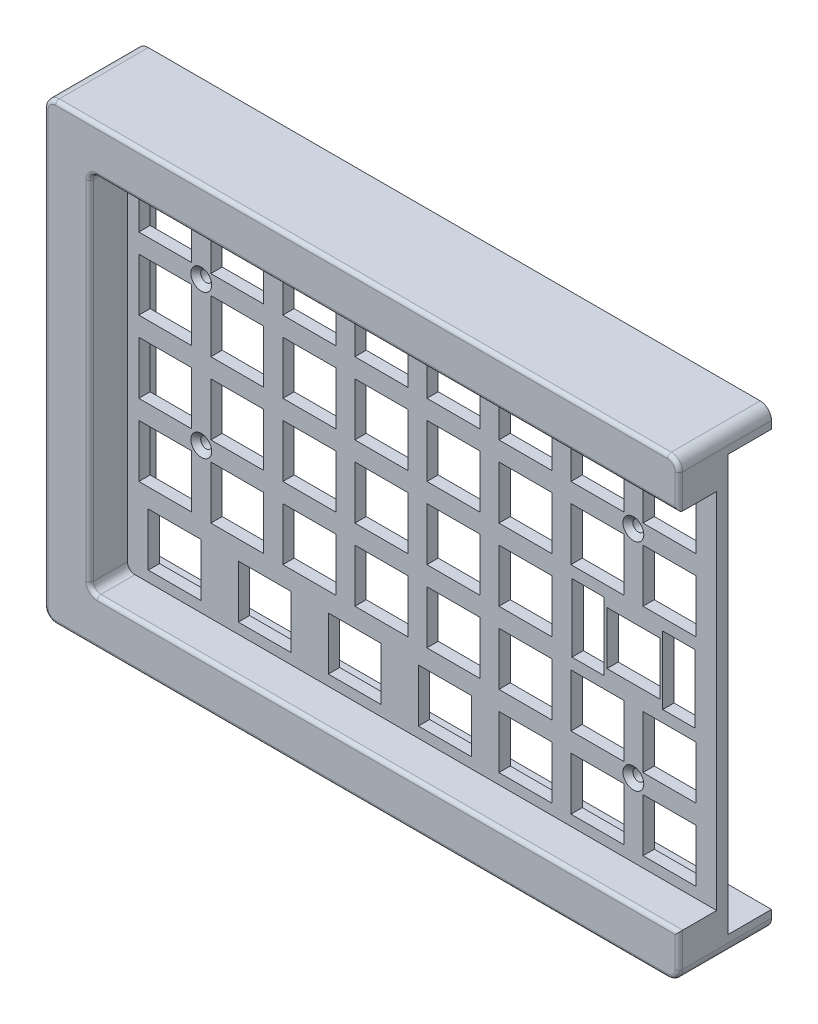
from build123d import *

# Parameters (mm, degrees)
MAIN_EXTRUSION_DEPTH                                 = 24.5
FRONT_CAVE_DEPTH                                     = 10
SKETCH2_W                                            = 14
SKETCH2_H                                            = 14
SKETCH2_W_2                                          = 8.5
SKETCH2_H_2                                          = 18
KEY_CUTOUTS_DEPTH                                    = 3
CSK_FOR_M2_5_COUNTERSUNK_FLAT_HEAD_SCREW_D           = 2.9
CSK_FOR_M2_5_COUNTERSUNK_FLAT_HEAD_SCREW_CSINK_D     = 5.5
CSK_FOR_M2_5_COUNTERSUNK_FLAT_HEAD_SCREW_CSINK_ANGLE = 90
SKETCH4_W                                            = 162.85
SKETCH4_H                                            = 110
CUT_EXTRUDE1_DEPTH                                   = 11.5
CUT_EXTRUDE3_DEPTH                                   = 2.5
CUT_EXTRUDE4_DEPTH                                   = 2.5
FILLET1_R                                            = 1
SKETCH10_W                                           = 3.2
SKETCH10_H                                           = 60
CUT_EXTRUDE5_DEPTH                                   = 8


with BuildPart() as part:
    # Sketch1 → Main Extrusion (new body)
    with BuildSketch(Plane.XY):
        with BuildLine():
            Line((-80.925, -60), (80.925, -60))
            ThreePointArc((80.925, -60), (83.046320344, -59.121320344), (83.925, -57))
            Line((83.925, -57), (83.925, 57))
            ThreePointArc((83.925, 57), (83.046320344, 59.121320344), (80.925, 60))
            Line((80.925, 60), (-80.925, 60))
            ThreePointArc((-80.925, 60), (-83.046320344, 59.121320344), (-83.925, 57))
            Line((-83.925, 57), (-83.925, -57))
            ThreePointArc((-83.925, -57), (-83.046320344, -59.121320344), (-80.925, -60))
        make_face()
    extrude(amount=MAIN_EXTRUSION_DEPTH)

    # Sketch3 → Front Cave (cut)
    with BuildSketch(Plane.XY.offset(24.5)):
        with BuildLine():
            Line((-69.925, 48), (82.025, 48))
            Line((82.025, 48), (83.925, 48))
            Line((83.925, 48), (83.925, 46))
            Line((83.925, 46), (83.925, -46))
            Line((83.925, -46), (83.925, -48))
            Line((83.925, -48), (82.025, -48))
            Line((82.025, -48), (-69.925, -48))
            ThreePointArc((-69.925, -48), (-71.339213562, -47.414213562), (-71.925, -46))
            Line((-71.925, -46), (-71.925, 46))
            ThreePointArc((-71.925, 46), (-71.339213562, 47.414213562), (-69.925, 48))
        make_face()
    extrude(amount=-FRONT_CAVE_DEPTH, mode=Mode.SUBTRACT)

    # Sketch2 → Key Cutouts (cut)
    with BuildSketch(Plane.XY.offset(14.5)):
        with Locations((-61.925, 38)):
            Rectangle(SKETCH2_W, SKETCH2_H)
        with Locations((-42.875, 38)):
            Rectangle(SKETCH2_W, SKETCH2_H)
        with Locations((-23.825, 38)):
            Rectangle(SKETCH2_W, SKETCH2_H)
        with Locations((-4.775, 38)):
            Rectangle(SKETCH2_W, SKETCH2_H)
        with Locations((14.275, 38)):
            Rectangle(SKETCH2_W, SKETCH2_H)
        with Locations((33.325, 38)):
            Rectangle(SKETCH2_W, SKETCH2_H)
        with Locations((52.375, 38)):
            Rectangle(SKETCH2_W, SKETCH2_H)
        with Locations((-35.613, -38.2)):
            Rectangle(SKETCH2_W, SKETCH2_H)
        with Locations((-59.425, -38.2)):
            Rectangle(SKETCH2_W, SKETCH2_H)
        with Locations((-11.801, -38.2)):
            Rectangle(SKETCH2_W, SKETCH2_H)
        with Locations((12.011, -38.2)):
            Rectangle(SKETCH2_W, SKETCH2_H)
        with Locations((73.9, -0.1)):
            Rectangle(SKETCH2_W_2, SKETCH2_H_2)
        with Locations((71.425, 38)):
            Rectangle(SKETCH2_W, SKETCH2_H)
        with Locations((-61.925, 18.95)):
            Rectangle(SKETCH2_W, SKETCH2_H)
        with Locations((-42.875, 18.95)):
            Rectangle(SKETCH2_W, SKETCH2_H)
        with Locations((-23.825, 18.95)):
            Rectangle(SKETCH2_W, SKETCH2_H)
        with Locations((-4.775, 18.95)):
            Rectangle(SKETCH2_W, SKETCH2_H)
        with Locations((14.275, 18.95)):
            Rectangle(SKETCH2_W, SKETCH2_H)
        with Locations((33.325, 18.95)):
            Rectangle(SKETCH2_W, SKETCH2_H)
        with Locations((52.375, 18.95)):
            Rectangle(SKETCH2_W, SKETCH2_H)
        with Locations((71.425, 18.95)):
            Rectangle(SKETCH2_W, SKETCH2_H)
        with Locations((-61.925, -0.1)):
            Rectangle(SKETCH2_W, SKETCH2_H)
        with Locations((-42.875, -0.1)):
            Rectangle(SKETCH2_W, SKETCH2_H)
        with Locations((-23.825, -0.1)):
            Rectangle(SKETCH2_W, SKETCH2_H)
        with Locations((-4.775, -0.1)):
            Rectangle(SKETCH2_W, SKETCH2_H)
        with Locations((14.275, -0.1)):
            Rectangle(SKETCH2_W, SKETCH2_H)
        with Locations((33.325, -0.1)):
            Rectangle(SKETCH2_W, SKETCH2_H)
        with Locations((-61.925, -19.15)):
            Rectangle(SKETCH2_W, SKETCH2_H)
        with Locations((-42.875, -19.15)):
            Rectangle(SKETCH2_W, SKETCH2_H)
        with Locations((-23.825, -19.15)):
            Rectangle(SKETCH2_W, SKETCH2_H)
        with Locations((-4.775, -19.15)):
            Rectangle(SKETCH2_W, SKETCH2_H)
        with Locations((14.275, -19.15)):
            Rectangle(SKETCH2_W, SKETCH2_H)
        with Locations((33.325, -19.15)):
            Rectangle(SKETCH2_W, SKETCH2_H)
        with Locations((52.375, -19.15)):
            Rectangle(SKETCH2_W, SKETCH2_H)
        with Locations((71.425, -19.15)):
            Rectangle(SKETCH2_W, SKETCH2_H)
        with Locations((61.9, -0.1)):
            Rectangle(SKETCH2_W, SKETCH2_H)
        with Locations((49.9, -0.1)):
            Rectangle(SKETCH2_W_2, SKETCH2_H_2)
        with Locations((33.325, -38.2)):
            Rectangle(SKETCH2_W, SKETCH2_H)
        with Locations((52.375, -38.2)):
            Rectangle(SKETCH2_W, SKETCH2_H)
        with Locations((71.425, -38.2)):
            Rectangle(SKETCH2_W, SKETCH2_H)
    extrude(amount=-KEY_CUTOUTS_DEPTH, mode=Mode.SUBTRACT)

    # CSK for M2.5 Countersunk Flat Head Screw1 (through all)
    with Locations(Plane(origin=(-52.4, 28.475, 14.5), x_dir=(1, 0, 0), z_dir=(0, 0, 1))):
        with Locations((0, 0), (114.295, -57.145), (0, -38.1), (114.295, -0.005)):
            CounterSinkHole(CSK_FOR_M2_5_COUNTERSUNK_FLAT_HEAD_SCREW_D / 2, CSK_FOR_M2_5_COUNTERSUNK_FLAT_HEAD_SCREW_CSINK_D / 2, counter_sink_angle=CSK_FOR_M2_5_COUNTERSUNK_FLAT_HEAD_SCREW_CSINK_ANGLE)

    # Sketch4 → Cut-Extrude1 (cut)
    with BuildSketch(Plane.XY):
        with Locations((2.5, 0)):
            Rectangle(SKETCH4_W, SKETCH4_H)
    extrude(amount=CUT_EXTRUDE1_DEPTH, mode=Mode.SUBTRACT)

    # Sketch7 → Cut-Extrude3 (cut)
    with BuildSketch(Plane.ZY.offset(83.925)):
        Polygon((0, 40), (7, 32), (7, -60), (0, -60), align=None)
    extrude(amount=-CUT_EXTRUDE3_DEPTH, mode=Mode.SUBTRACT)

    # Sketch8 → Cut-Extrude4 (cut)
    with BuildSketch(Plane.XZ.offset(60)):
        Polygon((-83.925, 0), (-83.925, 7), (55.925, 7), (63.925, 0), align=None)
    extrude(amount=-CUT_EXTRUDE4_DEPTH, mode=Mode.SUBTRACT)

    # Fillet1
    fillet1_edges = [part.edges().sort_by_distance(p)[0] for p in [
        (83.046320344, 59.121320344, 24.5),
        (0, 60, 24.5),
        (-83.046320344, 59.121320344, 24.5),
        (-83.925, 0, 24.5),
        (83.925, 52.5, 24.5),
        (-83.046320344, -59.121320344, 24.5),
        (0, -60, 24.5),
        (7, -48, 24.5),
        (7, 48, 24.5),
        (-71.339213562, 47.414213562, 24.5),
        (-71.925, 0, 24.5),
        (-71.339213562, -47.414213562, 24.5),
        (83.046320344, -59.121320344, 24.5),
        (-81.425, -57.5, 3.5),
        (83.925, -52.5, 24.5),
    ]]
    fillet(fillet1_edges, radius=FILLET1_R)

    # Sketch10 → Cut-Extrude5 (cut)
    with BuildSketch(Plane(origin=(0, 0, 11.5), x_dir=(-1, 0, 0), z_dir=(0, 0, -1))):
        with Locations((77.325, -25)):
            Rectangle(SKETCH10_W, SKETCH10_H)
    extrude(amount=-CUT_EXTRUDE5_DEPTH, mode=Mode.SUBTRACT)


solid = part.part
